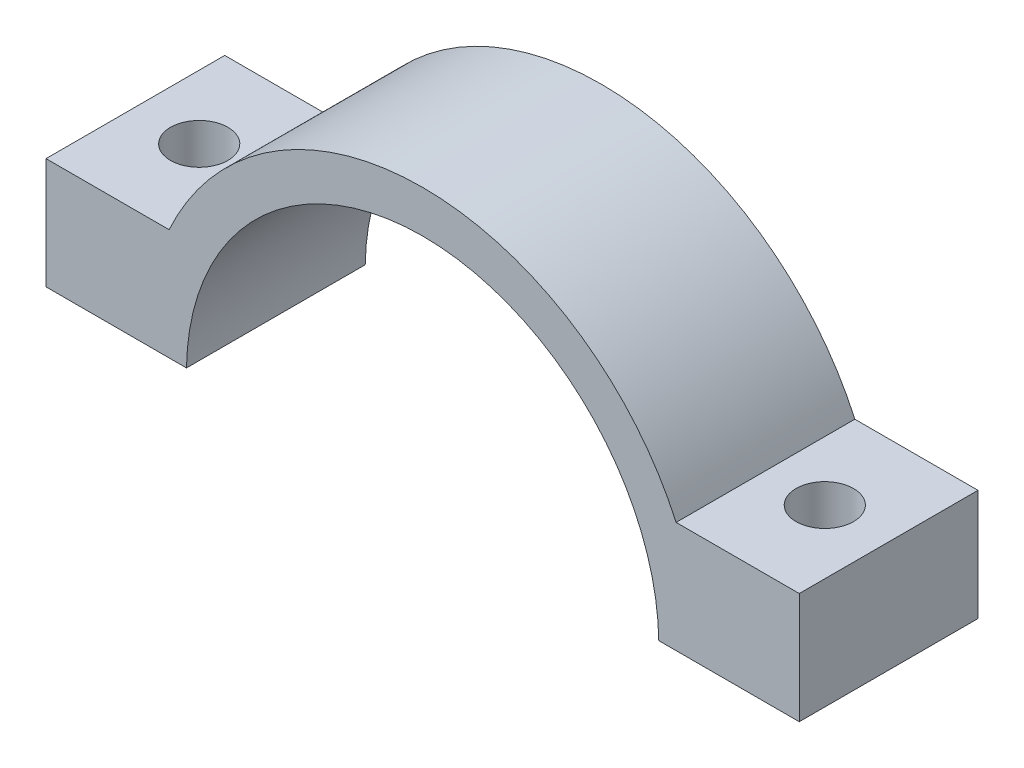
from build123d import *

# Parameters (mm, degrees)
SPLIT_CAP_WITH_RAISED_FLAT_WASHER_SEATS_DEPTH = 14
M4_THROUGH_HOLES_DEPTH                        = 60.969492244
M4_THROUGH_HOLES_DEPTH_BACK                   = 60.969492244
SKETCH2_R                                     = 2.25


with BuildPart() as part:
    # Split cap with raised flat washer se 2 → Split cap with raised flat washer seats (new body)
    with BuildSketch(Plane.XY):
        with BuildLine():
            Line((19.855477834, 37.5), (29.5, 37.5))
            Line((29.5, 37.5), (29.5, 28.8))
            Line((29.5, 28.8), (18.497567408, 28.8))
            ThreePointArc((18.497567408, 28.8), (0, 47), (-18.497567408, 28.8))
            Line((-18.497567408, 28.8), (-29.5, 28.8))
            Line((-29.5, 28.8), (-29.5, 37.5))
            Line((-29.5, 37.5), (-19.855477834, 37.5))
            ThreePointArc((-19.855477834, 37.5), (0, 50.3), (19.855477834, 37.5))
        make_face()
    extrude(amount=SPLIT_CAP_WITH_RAISED_FLAT_WASHER_SEATS_DEPTH)

    # Sketch2 → M4 through holes (cut, two sides: drawn at the far end of the back side and taken through both)
    with BuildSketch(Plane(origin=(0, 0, 0), x_dir=(1, 0, 0), z_dir=(0, 1, 0)).offset(-M4_THROUGH_HOLES_DEPTH_BACK)):
        with Locations(Location((-24.5, -7, 0), (0, 0, 90))):
            Circle(SKETCH2_R)
        with Locations(Location((24.5, -7, 0), (0, 0, 90))):
            Circle(SKETCH2_R)
    extrude(amount=M4_THROUGH_HOLES_DEPTH + M4_THROUGH_HOLES_DEPTH_BACK, mode=Mode.SUBTRACT)


solid = part.part
